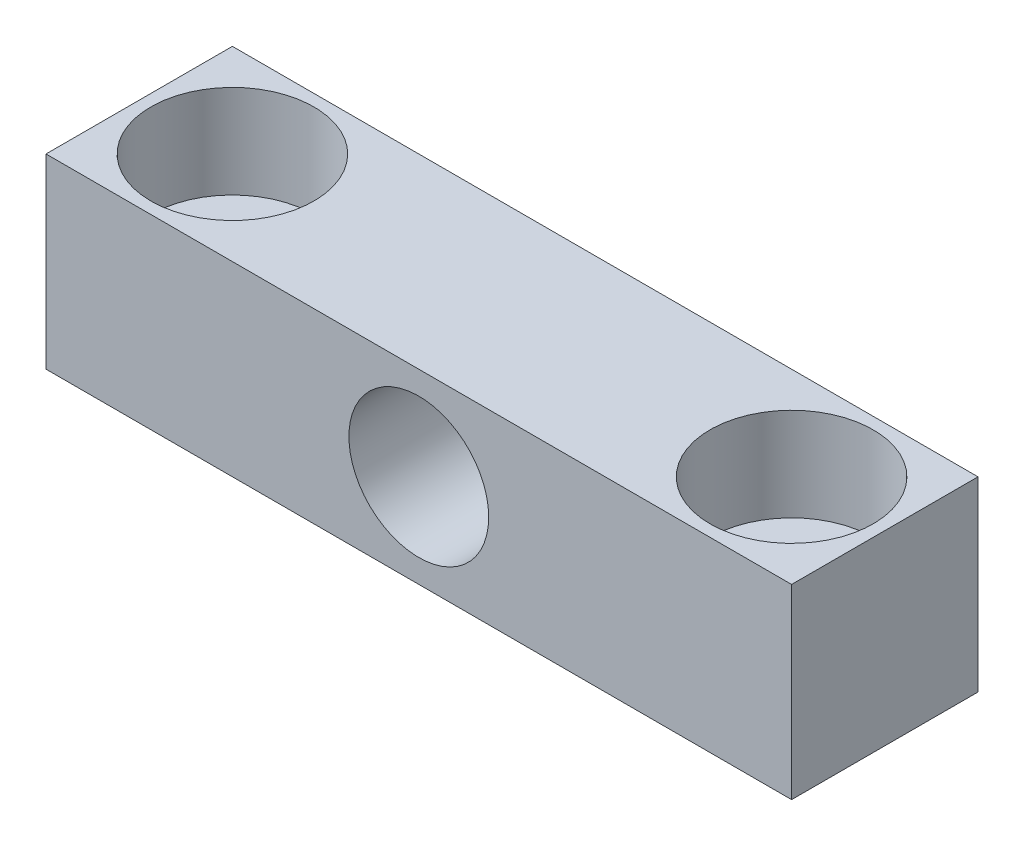
from build123d import *

# Parameters (mm, degrees)
SKETCH1_W                                        = 50.8
SKETCH1_H                                        = 12.7
EXTRUDE1_DEPTH                                   = 12.7
SKETCH3_R                                        = 4.7625
CUT_EXTRUDE2_DEPTH                               = 32.108519733
CBORE_FOR_1_4_SOCKET_HEAD_CAP_SCREW1_D           = 6.7564
CBORE_FOR_1_4_SOCKET_HEAD_CAP_SCREW1_CBORE_D     = 11.1125
CBORE_FOR_1_4_SOCKET_HEAD_CAP_SCREW1_CBORE_DEPTH = 6.35


with BuildPart() as part:
    # Sketch1 → Extrude1 (new body)
    with BuildSketch(Plane(origin=(0, 0, 0), x_dir=(1, 0, 0), z_dir=(0, 1, 0))):
        Rectangle(SKETCH1_W, SKETCH1_H)
    extrude(amount=EXTRUDE1_DEPTH)

    # Sketch3 → Cut-Extrude2 (cut, through all)
    with BuildSketch(Plane.XY.offset(6.35)):
        with Locations((0, 6.35)):
            Circle(SKETCH3_R)
    extrude(amount=-CUT_EXTRUDE2_DEPTH, mode=Mode.SUBTRACT)

    # CBORE for 1/4 Socket Head Cap Screw1 (through all)
    with Locations(Plane(origin=(0, 12.7, 0), x_dir=(-1, 0, 0), z_dir=(0, 1, 0))):
        with Locations((-19.05, 0), (19.05, 0)):
            CounterBoreHole(CBORE_FOR_1_4_SOCKET_HEAD_CAP_SCREW1_D / 2, CBORE_FOR_1_4_SOCKET_HEAD_CAP_SCREW1_CBORE_D / 2, CBORE_FOR_1_4_SOCKET_HEAD_CAP_SCREW1_CBORE_DEPTH)


solid = part.part
